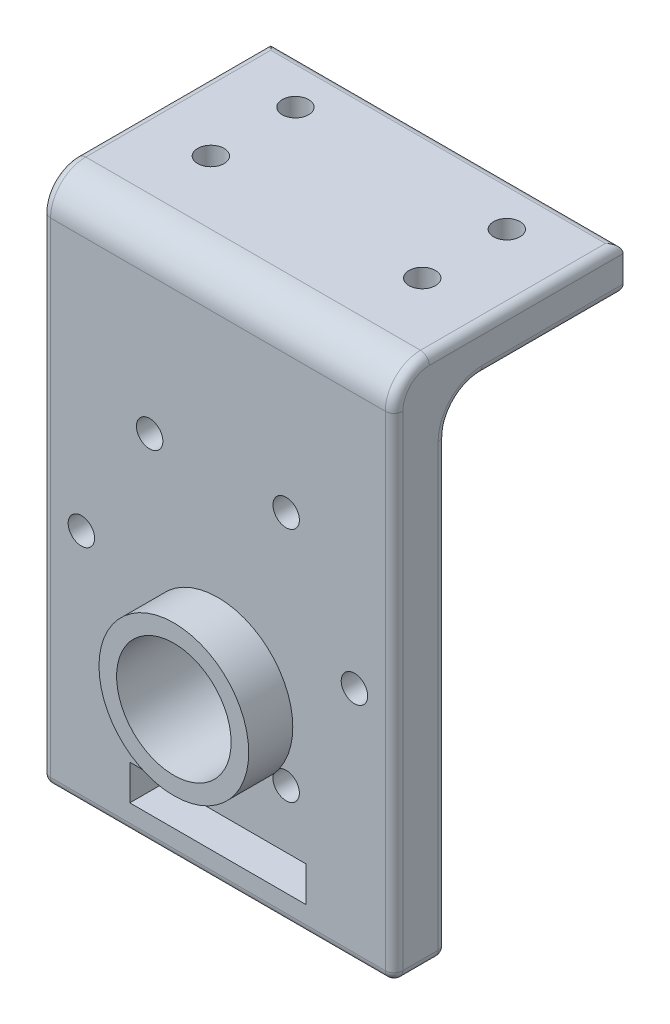
from build123d import *

# Parameters (mm, degrees)
SKETCH_1_W          = 40
SKETCH_1_H          = 60
EXTRUDE_1_DEPTH     = 6
SKETCH_2_W          = 40
SKETCH_2_H          = 5
EXTRUDE_2_DEPTH     = 20
SKETCH_3_R          = 1.5
CUT_EXTRUDE_1_DEPTH = 20
SKETCH_5_R          = 8.5
EXTRUDE_3_DEPTH     = 5
SKETCH_7_R          = 6.5
CUT_EXTRUDE_3_DEPTH = 27
SKETCH_8_R          = 1.5
CUT_EXTRUDE_5_DEPTH = 27
SKETCH_9_W          = 20
SKETCH_9_H          = 4
CUT_EXTRUDE_6_DEPTH = 27
FILLET_1_R          = 4
FILLET_2_R          = 1


with BuildPart() as part:
    # 草图1 → 凸台-拉伸1 (new body)
    with BuildSketch(Plane.XY):
        with Locations((20, -30)):
            Rectangle(SKETCH_1_W, SKETCH_1_H)
    extrude(amount=EXTRUDE_1_DEPTH)

    # 草图2 → 凸台-拉伸2 (add)
    with BuildSketch(Plane(origin=(0, 0, 0), x_dir=(-1, 0, 0), z_dir=(0, 0, -1))):
        with Locations((-20, -2.5)):
            Rectangle(SKETCH_2_W, SKETCH_2_H)
    extrude(amount=EXTRUDE_2_DEPTH)

    # 草图3 → 切除-拉伸1 (cut)
    with BuildSketch(Plane.XY.offset(6)):
        with Locations((35.5, -33)):
            Circle(SKETCH_3_R)
        with Locations((27.75, -46.423393759)):
            Circle(SKETCH_3_R)
        with Locations((12.25, -46.423393759)):
            Circle(SKETCH_3_R)
        with Locations((4.5, -33)):
            Circle(SKETCH_3_R)
        with Locations((12.25, -19.576606241)):
            Circle(SKETCH_3_R)
        with Locations((27.75, -19.576606241)):
            Circle(SKETCH_3_R)
    extrude(amount=-CUT_EXTRUDE_1_DEPTH, mode=Mode.SUBTRACT)

    # 草图5 → 凸台-拉伸3 (add)
    with BuildSketch(Plane.XY.offset(6)):
        with Locations(Location((20, -40.3, 0), (0, 0, 214.594788024))):
            Circle(SKETCH_5_R)
    extrude(amount=EXTRUDE_3_DEPTH)

    # 草图7 → 切除-拉伸3 (cut)
    with BuildSketch(Plane.XY.offset(11)):
        with Locations((20, -40.3)):
            Circle(SKETCH_7_R)
    extrude(amount=-CUT_EXTRUDE_3_DEPTH, mode=Mode.SUBTRACT)

    # 草图8 → 切除-拉伸5 (cut)
    with BuildSketch(Plane(origin=(0, 0, 0), x_dir=(1, 0, 0), z_dir=(0, 1, 0))):
        with BuildLine():
            ThreePointArc((9.5, 14.8), (8.426322568, 16.238140837), (6.742334576, 15.617482526))
            Line((6.742334576, 15.617482526), (9.257665424, 13.982517474))
            ThreePointArc((9.257665424, 13.982517474), (9.438140837, 14.373677432), (9.5, 14.8))
        make_face()
        with BuildLine():
            Line((9.257665424, 13.982517474), (6.742334576, 15.617482526))
            ThreePointArc((6.742334576, 15.617482526), (7.182517474, 13.542334576), (9.257665424, 13.982517474))
        make_face()
        with Locations(Location((8, 5.2, 0), (0, 0, 270))):
            Circle(SKETCH_8_R)
        with Locations(Location((32, 14.8, 0), (0, 0, 270))):
            Circle(SKETCH_8_R)
        with Locations(Location((32, 5.2, 0), (0, 0, 270))):
            Circle(SKETCH_8_R)
    extrude(amount=-CUT_EXTRUDE_5_DEPTH, mode=Mode.SUBTRACT)

    # 草图9 → 切除-拉伸6 (cut)
    with BuildSketch(Plane(origin=(0, 0, 0), x_dir=(-1, 0, 0), z_dir=(0, 0, -1))):
        with Locations((-20, -55)):
            Rectangle(SKETCH_9_W, SKETCH_9_H)
    extrude(amount=-CUT_EXTRUDE_6_DEPTH, mode=Mode.SUBTRACT)

    # 圆角1
    fillet_1_edges = [part.edges().sort_by_distance(p)[0] for p in [
        (20, -5, 0),
        (20, 0, 6),
    ]]
    fillet(fillet_1_edges, radius=FILLET_1_R)

    # 圆角2
    fillet_2_edges = [part.edges().sort_by_distance(p)[0] for p in [
        (0, -34.5, 0),
        (0, -32, 6),
        (0, 0, -9),
        (0, -1.171572875, 4.828427125),
        (40, -32, 6),
        (40, 0, -9),
        (40, -1.171572875, 4.828427125),
        (0, -6.171572875, -1.171572875),
        (40, -6.171572875, -1.171572875),
        (40, -5, -12),
        (0, -5, -12),
        (20, -5, -20),
        (20, 0, -20),
        (40, -34.5, 0),
        (20, -60, 0),
        (40, -60, 3),
        (0, -60, 3),
        (20, -60, 6),
    ]]
    fillet(fillet_2_edges, radius=FILLET_2_R)


solid = part.part
